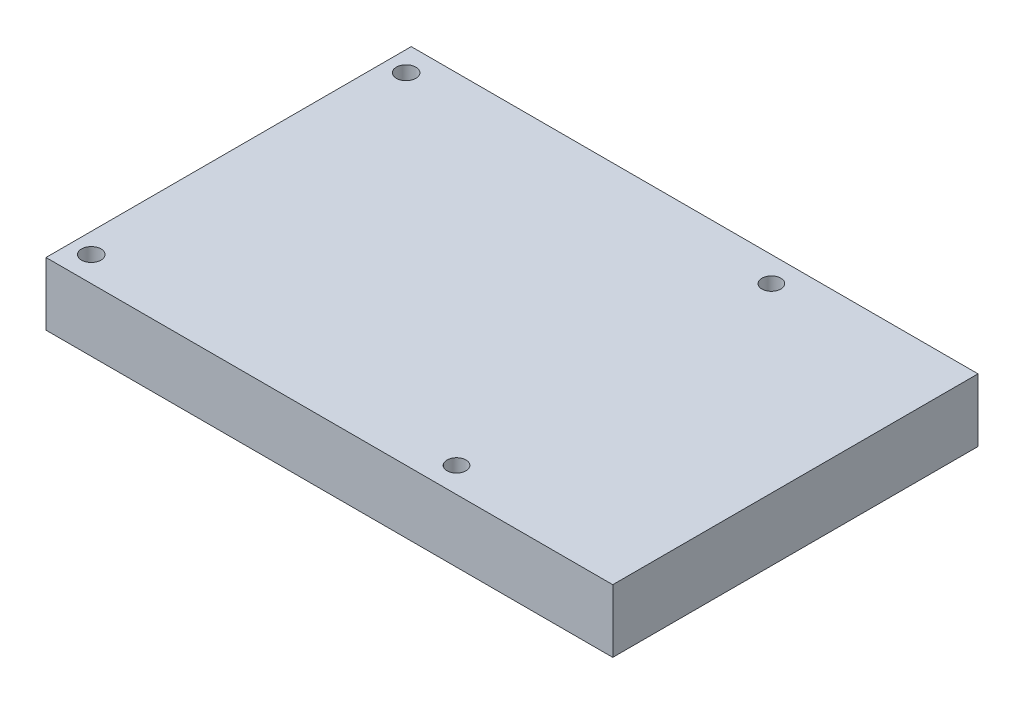
from build123d import *

# Parameters (mm, degrees)
SKETCH_1_W          = 90
SKETCH_1_H          = 58
EXTRUDE_1_DEPTH     = 10
SKETCH_2_R          = 1.55
SKETCH_2_R_2        = 1.5
CUT_EXTRUDE_1_DEPTH = 10


with BuildPart() as part:
    # 草图1 → 凸台-拉伸1 (new body)
    with BuildSketch(Plane(origin=(0, 0, 0), x_dir=(1, 0, 0), z_dir=(0, 1, 0))):
        Rectangle(SKETCH_1_W, SKETCH_1_H)
    extrude(amount=EXTRUDE_1_DEPTH)

    # 草图2 → 切除-拉伸1 (cut)
    with BuildSketch(Plane(origin=(0, 10, 0), x_dir=(1, 0, 0), z_dir=(0, 1, 0))):
        with Locations(Location((-41.809653522, 25, 0), (0, 0, 270))):
            Circle(SKETCH_2_R)
        with Locations(Location((16.190346478, 25, 0), (0, 0, 270))):
            Circle(SKETCH_2_R_2)
        with Locations(Location((-41.809653522, -25, 0), (0, 0, 90))):
            Circle(SKETCH_2_R)
        with Locations(Location((16.190346478, -25, 0), (0, 0, 90))):
            Circle(SKETCH_2_R_2)
    extrude(amount=-CUT_EXTRUDE_1_DEPTH, mode=Mode.SUBTRACT)


solid = part.part
